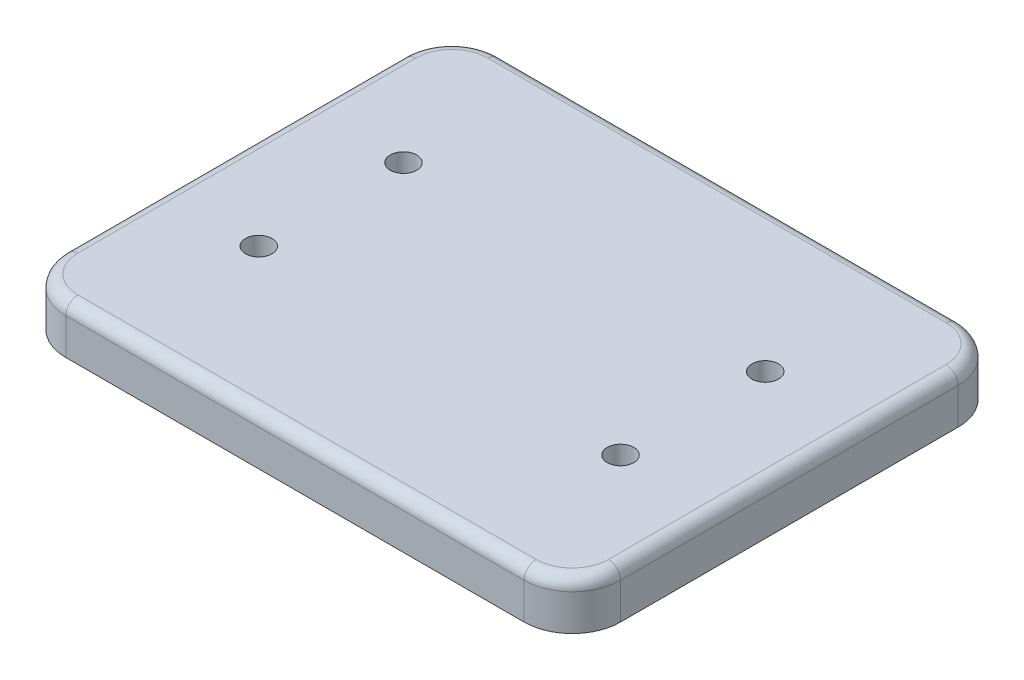
from build123d import *

# Parameters (mm, degrees)
BOSS_EXTRUDE1_DEPTH     = 20
FILLET1_R               = 5
SKETCH3_R               = 5.5
CUT_EXTRUDE1_DEPTH      = 148.39402973
SKETCH4_R               = 9
CUT_EXTRUDE2_DEPTH      = 11
MIRROR2_COPY_1_SKETCH_R = 5.5
MIRROR2_COPY_1_DEPTH    = 148.39402973
MIRROR2_COPY_2_SKETCH_R = 9
MIRROR2_COPY_2_DEPTH    = 11


with BuildPart() as part:
    # Sketch1 → Boss-Extrude1 (new body)
    with BuildSketch(Plane(origin=(0, 0, 0), x_dir=(1, 0, 0), z_dir=(0, 1, 0))):
        with BuildLine():
            Line((-95, -90), (95, -90))
            ThreePointArc((95, -90), (109.142135624, -84.142135624), (115, -70))
            Line((115, -70), (115, 70))
            ThreePointArc((115, 70), (109.142135624, 84.142135624), (95, 90))
            Line((95, 90), (-95, 90))
            ThreePointArc((-95, 90), (-109.142135624, 84.142135624), (-115, 70))
            Line((-115, 70), (-115, -70))
            ThreePointArc((-115, -70), (-109.142135624, -84.142135624), (-95, -90))
        make_face()
    extrude(amount=-BOSS_EXTRUDE1_DEPTH)

    # Fillet1
    fillet1_edges = [part.edges().sort_by_distance(p)[0] for p in [
        (0, 0, 90),
        (-109.142135624, 0, 84.142135624),
        (-115, 0, 0),
        (-109.142135624, 0, -84.142135624),
        (0, 0, -90),
        (109.142135624, 0, -84.142135624),
        (115, 0, 0),
        (109.142135624, 0, 84.142135624),
    ]]
    fillet(fillet1_edges, radius=FILLET1_R)

    # Sketch3 → Cut-Extrude1 (cut, through all)
    with BuildSketch(Plane(origin=(0, 0, 0), x_dir=(1, 0, 0), z_dir=(0, 1, 0))):
        with Locations(Location((-75, 30, 0), (0, 0, 270))):
            Circle(SKETCH3_R)
    cut_extrude1 = extrude(amount=-CUT_EXTRUDE1_DEPTH, mode=Mode.SUBTRACT)

    # Sketch4 → Cut-Extrude2 (cut)
    with BuildSketch(Plane.XZ.offset(20)):
        with Locations(Location((-75, -30, 0), (0, 0, 270))):
            Circle(SKETCH4_R)
    cut_extrude2 = extrude(amount=-CUT_EXTRUDE2_DEPTH, mode=Mode.SUBTRACT)

    # Mirror1: Cut-Extrude1, Cut-Extrude2 across plane
    add(cut_extrude1.mirror(Plane(origin=(0, 0, 0), x_dir=(0, 0, 1), z_dir=(1, 0, 0))), mode=Mode.SUBTRACT)
    add(cut_extrude2.mirror(Plane(origin=(0, 0, 0), x_dir=(0, 0, 1), z_dir=(1, 0, 0))), mode=Mode.SUBTRACT)

    # Mirror2: Cut-Extrude1, Cut-Extrude2 across plane
    add(cut_extrude1.mirror(Plane.XY), mode=Mode.SUBTRACT)
    add(cut_extrude2.mirror(Plane.XY), mode=Mode.SUBTRACT)

    # Mirror2 copy 1 sketch → Mirror2 copy 1 (cut, through all)
    with BuildSketch(Plane(origin=(0, 0, 0), x_dir=(-1, 0, 0), z_dir=(0, 1, 0))):
        with Locations(Location((-75, 30, 0), (0, 0, 270))):
            Circle(MIRROR2_COPY_1_SKETCH_R)
    extrude(amount=-MIRROR2_COPY_1_DEPTH, mode=Mode.SUBTRACT)

    # Mirror2 copy 2 sketch → Mirror2 copy 2 (cut)
    with BuildSketch(Plane(origin=(0, -20, 0), x_dir=(-1, 0, 0), z_dir=(0, -1, 0))):
        with Locations(Location((-75, -30, 0), (0, 0, 270))):
            Circle(MIRROR2_COPY_2_SKETCH_R)
    extrude(amount=-MIRROR2_COPY_2_DEPTH, mode=Mode.SUBTRACT)


solid = part.part
